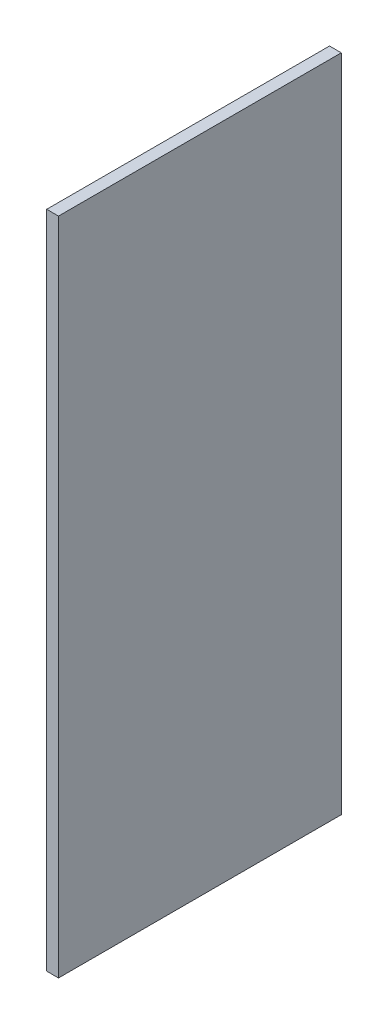
from build123d import *

# Parameters (mm, degrees)
SKIZZE1_W                       = 120
SKIZZE1_H                       = 280
AUFSATZ_LINEAR_AUSTRAGEN1_DEPTH = 5


with BuildPart() as part:
    # Skizze1 → Aufsatz-Linear austragen1 (new body)
    with BuildSketch(Plane(origin=(0, 0, 0), x_dir=(0, 0, -1), z_dir=(1, 0, 0))):
        Rectangle(SKIZZE1_W, SKIZZE1_H)
    extrude(amount=AUFSATZ_LINEAR_AUSTRAGEN1_DEPTH)


solid = part.part
